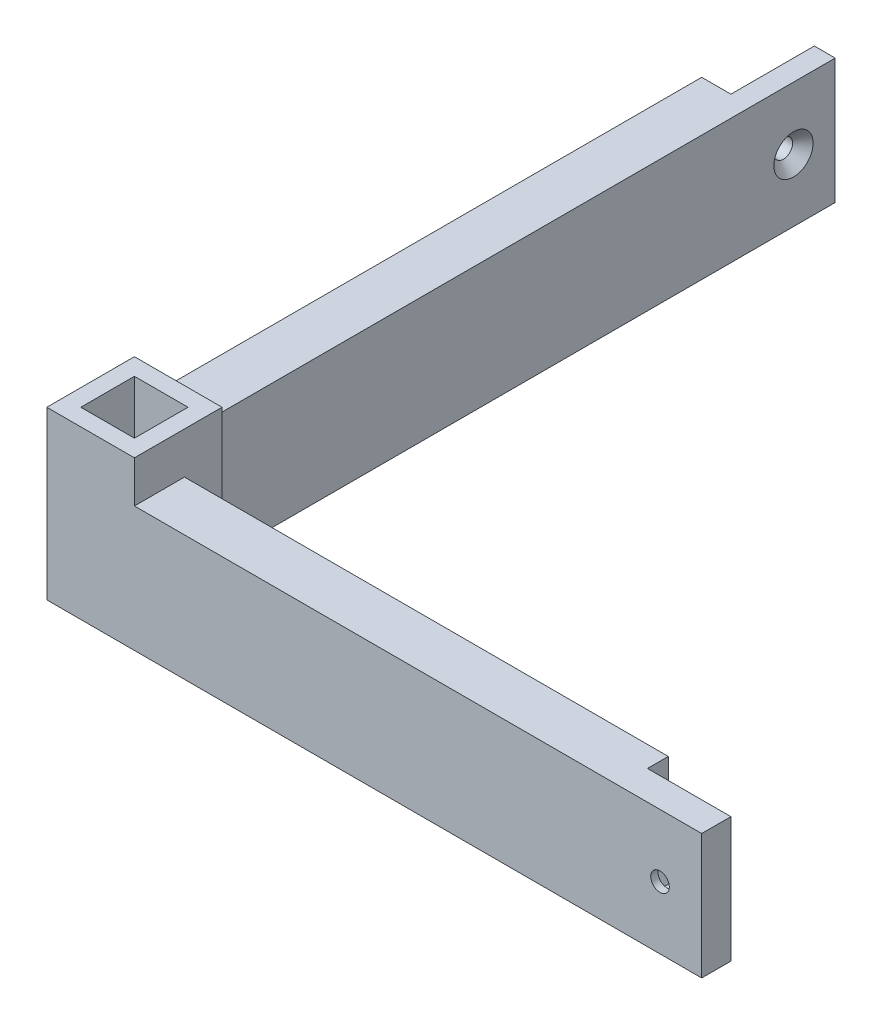
from build123d import *

# Parameters (mm, degrees)
SKETCH1_W                                           = 21
SKETCH1_H                                           = 40
BOSS_EXTRUDE1_DEPTH                                 = 21
SKETCH8_W                                           = 12.85
SKETCH8_H                                           = 12.85
CUT_EXTRUDE2_DEPTH                                  = 40
SKETCH7_W                                           = 12
SKETCH7_H                                           = 30
BOSS_EXTRUDE5_DEPTH                                 = 156
SKETCH9_W                                           = 12
SKETCH9_H                                           = 30
BOSS_EXTRUDE6_DEPTH                                 = 116
SKETCH10_W                                          = 6
SKETCH10_H                                          = 30
BOSS_EXTRUDE7_DEPTH                                 = 20
SKETCH11_W                                          = 7
SKETCH11_H                                          = 30
CUT_EXTRUDE3_DEPTH                                  = 20
CUT_EXTRUDE7_DEPTH                                  = 4.25
CSK_FOR_M4_COUNTERSUNK_FLAT_HEAD_SCREW1_D           = 4.5
CSK_FOR_M4_COUNTERSUNK_FLAT_HEAD_SCREW1_DEPTH       = 16
CSK_FOR_M4_COUNTERSUNK_FLAT_HEAD_SCREW1_CSINK_D     = 9.4
CSK_FOR_M4_COUNTERSUNK_FLAT_HEAD_SCREW1_CSINK_ANGLE = 90
CSK_FOR_M4_COUNTERSUNK_FLAT_HEAD_SCREW1_TIP         = 1.351936393
BOSS_EXTRUDE10_DEPTH                                = 8
BOSS_EXTRUDE11_DEPTH                                = 8
SKETCH27_W                                          = 20
SKETCH27_H                                          = 30
BOSS_EXTRUDE12_DEPTH                                = 1
SKETCH18_R                                          = 2.226933834
CUT_EXTRUDE10_DEPTH                                 = 10.4


with BuildPart() as part:
    # Sketch1 → Boss-Extrude1 (new body)
    with BuildSketch(Plane(origin=(0, 0, 0), x_dir=(0, 0, -1), z_dir=(1, 0, 0))):
        with Locations((2.851327434, 3.994469027)):
            Rectangle(SKETCH1_W, SKETCH1_H)
    extrude(amount=BOSS_EXTRUDE1_DEPTH)

    # Sketch8 → Cut-Extrude2 (cut)
    with BuildSketch(Plane(origin=(0, 23.994469027, 0), x_dir=(1, 0, 0), z_dir=(0, 1, 0))):
        with Locations((10.5, 2.851327434)):
            Rectangle(SKETCH8_W, SKETCH8_H)
    extrude(amount=-CUT_EXTRUDE2_DEPTH, mode=Mode.SUBTRACT)

    # Sketch7 → Boss-Extrude5 (add)
    with BuildSketch(Plane(origin=(0, 0, -13.351327434), x_dir=(-1, 0, 0), z_dir=(0, 0, -1))):
        with Locations((-6, -1.005530973)):
            Rectangle(SKETCH7_W, SKETCH7_H)
    extrude(amount=BOSS_EXTRUDE5_DEPTH)

    # Sketch9 → Boss-Extrude6 (add)
    with BuildSketch(Plane(origin=(21, 0, 0), x_dir=(0, 0, -1), z_dir=(1, 0, 0))):
        with Locations((-1.648672566, -1.005530973)):
            Rectangle(SKETCH9_W, SKETCH9_H)
    extrude(amount=BOSS_EXTRUDE6_DEPTH)

    # Sketch10 → Boss-Extrude7 (add)
    with BuildSketch(Plane(origin=(137, 0, 0), x_dir=(0, 0, -1), z_dir=(1, 0, 0))):
        with Locations((-4.648672566, -1.005530973)):
            Rectangle(SKETCH10_W, SKETCH10_H)
    extrude(amount=BOSS_EXTRUDE7_DEPTH)

    # Sketch11 → Cut-Extrude3 (cut)
    with BuildSketch(Plane(origin=(0, 0, -169.351327434), x_dir=(-1, 0, 0), z_dir=(0, 0, -1))):
        with Locations((-3.5, -1.005530973)):
            Rectangle(SKETCH11_W, SKETCH11_H)
    extrude(amount=-CUT_EXTRUDE3_DEPTH, mode=Mode.SUBTRACT)

    # Sketch16 → Cut-Extrude7 (cut)
    with BuildSketch(Plane(origin=(0, 0, 1.648672566), x_dir=(-1, 0, 0), z_dir=(0, 0, -1))):
        Polygon((-149.064027212, 2.569469027), (-151.128054425, -1.005530973), (-149.064027212, -4.580530973), (-144.935972788, -4.580530973), (-142.871945575, -1.005530973), (-144.935972788, 2.569469027), align=None)
    extrude(amount=-CUT_EXTRUDE7_DEPTH, mode=Mode.SUBTRACT)

    # CSK for M4 Countersunk Flat Head Screw1
    with Locations(Plane(origin=(12, 0, 0), x_dir=(0, 0, 1), z_dir=(1, 0, 0))):
        with Locations((-159.351327434, 1.005530973)):
            CounterSinkHole(CSK_FOR_M4_COUNTERSUNK_FLAT_HEAD_SCREW1_D / 2, CSK_FOR_M4_COUNTERSUNK_FLAT_HEAD_SCREW1_CSINK_D / 2, depth=CSK_FOR_M4_COUNTERSUNK_FLAT_HEAD_SCREW1_DEPTH, counter_sink_angle=CSK_FOR_M4_COUNTERSUNK_FLAT_HEAD_SCREW1_CSINK_ANGLE)
            with Locations((0, 0, -(CSK_FOR_M4_COUNTERSUNK_FLAT_HEAD_SCREW1_DEPTH + CSK_FOR_M4_COUNTERSUNK_FLAT_HEAD_SCREW1_TIP / 2))):  # 118° drill point
                Cone(0, CSK_FOR_M4_COUNTERSUNK_FLAT_HEAD_SCREW1_D / 2, CSK_FOR_M4_COUNTERSUNK_FLAT_HEAD_SCREW1_TIP, mode=Mode.SUBTRACT)

    # Sketch24 → Boss-Extrude10 (add)
    with BuildSketch(Plane(origin=(0, -16.005530973, 0), x_dir=(-1, 0, 0), z_dir=(0, -1, 0))):
        Polygon((-21, 13.351327434), (-30, 4.351327434), (-21, 4.351327434), align=None)
    extrude(amount=-BOSS_EXTRUDE10_DEPTH)

    # Sketch25 → Boss-Extrude11 (add)
    with BuildSketch(Plane(origin=(0, -16.005530973, 0), x_dir=(-1, 0, 0), z_dir=(0, -1, 0))):
        Polygon((-21, 13.351327434), (-12, 22.351327434), (-12, 13.351327434), align=None)
    extrude(amount=-BOSS_EXTRUDE11_DEPTH)

    # Sketch27 → Boss-Extrude12 (add)
    with BuildSketch(Plane(origin=(0, 0, 1.648672566), x_dir=(-1, 0, 0), z_dir=(0, 0, -1))):
        with Locations((-147, -1.005530973)):
            Rectangle(SKETCH27_W, SKETCH27_H)
    extrude(amount=BOSS_EXTRUDE12_DEPTH)

    # Sketch18 → Cut-Extrude10 (cut)
    with BuildSketch(Plane(origin=(0, 0, 0.648672566), x_dir=(-1, 0, 0), z_dir=(0, 0, -1))):
        with Locations((-147, -1.005530973)):
            Circle(SKETCH18_R)
    extrude(amount=-CUT_EXTRUDE10_DEPTH, mode=Mode.SUBTRACT)


solid = part.part
